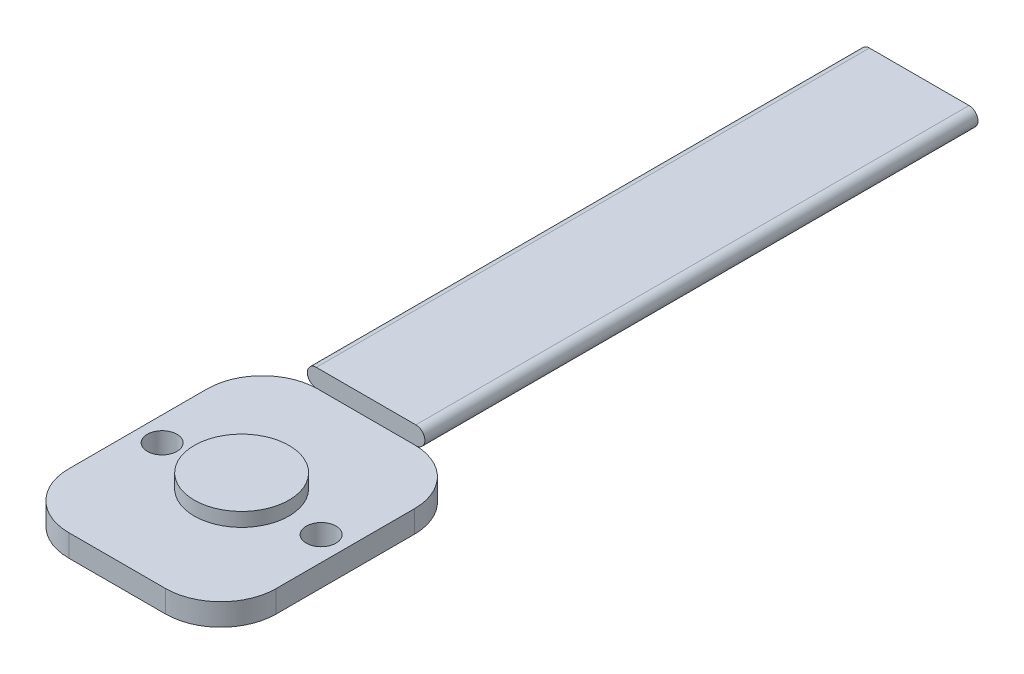
from build123d import *

# Parameters (mm, degrees)
SKETCH1_R           = 1.075
BOSS_EXTRUDE1_DEPTH = 1.6
SKETCH2_R           = 3.426475787
BOSS_EXTRUDE2_DEPTH = 1
BOSS_EXTRUDE3_DEPTH = 40


with BuildPart() as part:
    # Sketch1 → Boss-Extrude1 (new body)
    with BuildSketch(Plane(origin=(0, 0, 0), x_dir=(1, 0, 0), z_dir=(0, 1, 0))):
        with BuildLine():
            Line((-3.5, 9), (3.5, 9))
            ThreePointArc((3.5, 9), (6.328427125, 7.828427125), (7.5, 5))
            Line((7.5, 5), (7.5, -5))
            ThreePointArc((7.5, -5), (6.328427125, -7.828427125), (3.5, -9))
            Line((3.5, -9), (-3.5, -9))
            ThreePointArc((-3.5, -9), (-6.328427125, -7.828427125), (-7.5, -5))
            Line((-7.5, -5), (-7.5, 5))
            ThreePointArc((-7.5, 5), (-6.328427125, 7.828427125), (-3.5, 9))
        make_face()
        with Locations(Location((-5.75, 0, 0), (0, 0, 270))):
            Circle(SKETCH1_R, mode=Mode.SUBTRACT)
        with Locations(Location((5.75, 0, 0), (0, 0, 270))):
            Circle(SKETCH1_R, mode=Mode.SUBTRACT)
    extrude(amount=BOSS_EXTRUDE1_DEPTH)

    # Sketch2 → Boss-Extrude2 (add)
    with BuildSketch(Plane(origin=(0, 1.6, 0), x_dir=(1, 0, 0), z_dir=(0, 1, 0))):
        with Locations(Location((0, 0, 0), (0, 0, 270))):
            Circle(SKETCH2_R)
    extrude(amount=BOSS_EXTRUDE2_DEPTH)


with BuildPart() as body_2:
    # Sketch4 → Boss-Extrude3 (new body)
    with BuildSketch(Plane(origin=(0, 0, -9), x_dir=(-1, 0, 0), z_dir=(0, 0, -1))):
        with BuildLine():
            Line((3.6, 1.6), (-3.6, 1.6))
            ThreePointArc((-3.6, 1.6), (-4.25, 2.25), (-3.6, 2.9))
            Line((-3.6, 2.9), (3.6, 2.9))
            ThreePointArc((3.6, 2.9), (4.25, 2.25), (3.6, 1.6))
        make_face()
    extrude(amount=BOSS_EXTRUDE3_DEPTH)


solid = Compound([part.part, body_2.part])
